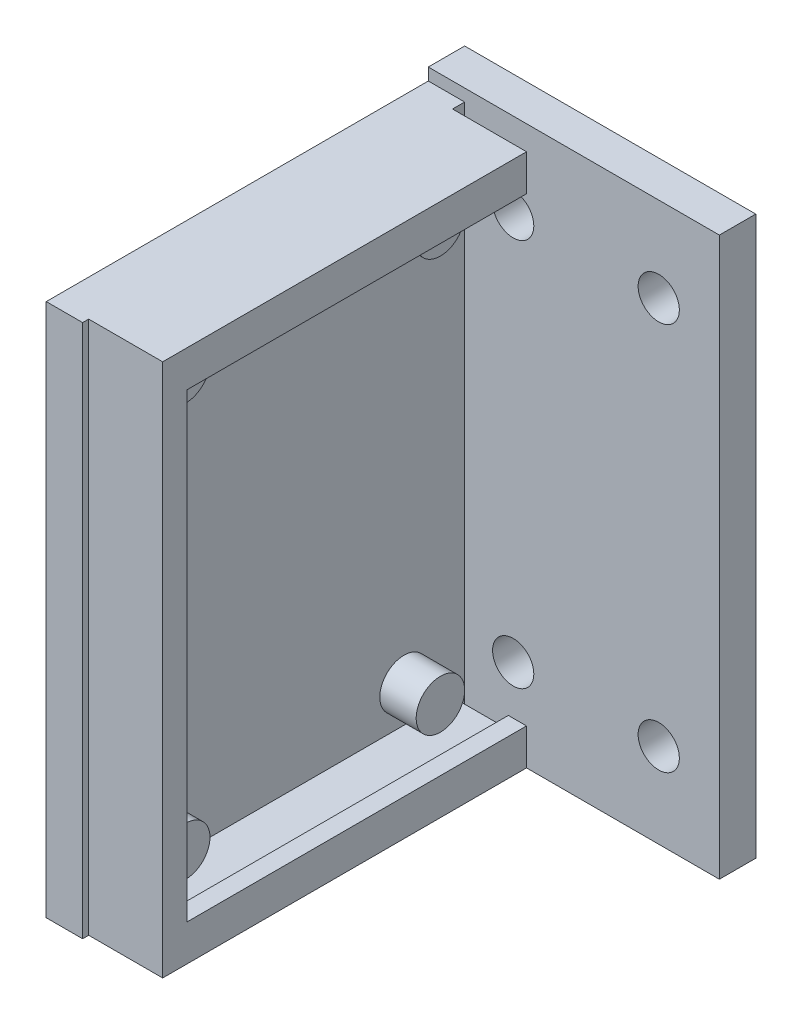
from build123d import *

# Parameters (mm, degrees)
MOUNTING_FOOT_SKETCH_W      = 24
MOUNTING_FOOT_SKETCH_H      = 46
MOUNTING_FOOT_DEPTH         = 3
BACK_PLATE_SKETCH_W         = 3
BACK_PLATE_SKETCH_H         = 44
BACK_PLATE_DEPTH            = 31.5
CLIP_RAILS_DEPTH            = 30
TOP_RETAINING_RAIL_SKETCH_W = 6.1
TOP_RETAINING_RAIL_SKETCH_H = 40
TOP_RETAINING_RAIL_DEPTH    = 2
PCB_SUPPORT_SKETCH_R        = 2
PCB_SUPPORTS_DEPTH          = 3
MOUNTING_HOLES_SKETCH_R     = 1.7
MOUNTING_HOLES_DEPTH        = 3.2


with BuildPart() as part:
    # Mounting Foot Sketch → Mounting Foot (new body)
    with BuildSketch(Plane.XY.offset(111.5)):
        with Locations((190, 0)):
            Rectangle(MOUNTING_FOOT_SKETCH_W, MOUNTING_FOOT_SKETCH_H)
    extrude(amount=MOUNTING_FOOT_DEPTH)

    # Back Plate Sketch → Back Plate (add)
    with BuildSketch(Plane.XY.offset(114.5)):
        with Locations((179.5, 0)):
            Rectangle(BACK_PLATE_SKETCH_W, BACK_PLATE_SKETCH_H)
    extrude(amount=BACK_PLATE_DEPTH)

    # Clip Rail Sketch → Clip Rails (add)
    with BuildSketch(Plane.XY.offset(115.5)):
        Polygon((181, -22), (187.1, -22), (187.1, -19), (185.6, -19), (185.6, -20), (181, -20), align=None)
        Polygon((181, 20), (185.6, 20), (185.6, 19), (187.1, 19), (187.1, 22), (181, 22), align=None)
    extrude(amount=CLIP_RAILS_DEPTH)

    # Top Retaining Rail Sketch → Top Retaining Rail (add)
    with BuildSketch(Plane.XY.offset(143.5)):
        with Locations((184.05, 0)):
            Rectangle(TOP_RETAINING_RAIL_SKETCH_W, TOP_RETAINING_RAIL_SKETCH_H)
    extrude(amount=TOP_RETAINING_RAIL_DEPTH)

    # PCB Support Sketch → PCB Supports (add)
    with BuildSketch(Plane(origin=(181, 0, 0), x_dir=(0, 0, -1), z_dir=(1, 0, 0))):
        with Locations(Location((-119.5, -17, 0), (0, 0, 180))):
            Circle(PCB_SUPPORT_SKETCH_R)
        with Locations(Location((-140.5, -17, 0), (0, 0, 180))):
            Circle(PCB_SUPPORT_SKETCH_R)
        with Locations(Location((-119.5, 17, 0), (0, 0, 180))):
            Circle(PCB_SUPPORT_SKETCH_R)
        with Locations(Location((-140.5, 17, 0), (0, 0, 180))):
            Circle(PCB_SUPPORT_SKETCH_R)
    extrude(amount=PCB_SUPPORTS_DEPTH)

    # Mounting Holes Sketch → Mounting Holes (cut)
    with BuildSketch(Plane.XY.offset(111.4)):
        with Locations((185, -16)):
            Circle(MOUNTING_HOLES_SKETCH_R)
        with Locations((185, 16)):
            Circle(MOUNTING_HOLES_SKETCH_R)
        with Locations((197, -16)):
            Circle(MOUNTING_HOLES_SKETCH_R)
        with Locations((197, 16)):
            Circle(MOUNTING_HOLES_SKETCH_R)
    extrude(amount=MOUNTING_HOLES_DEPTH, mode=Mode.SUBTRACT)


solid = part.part
